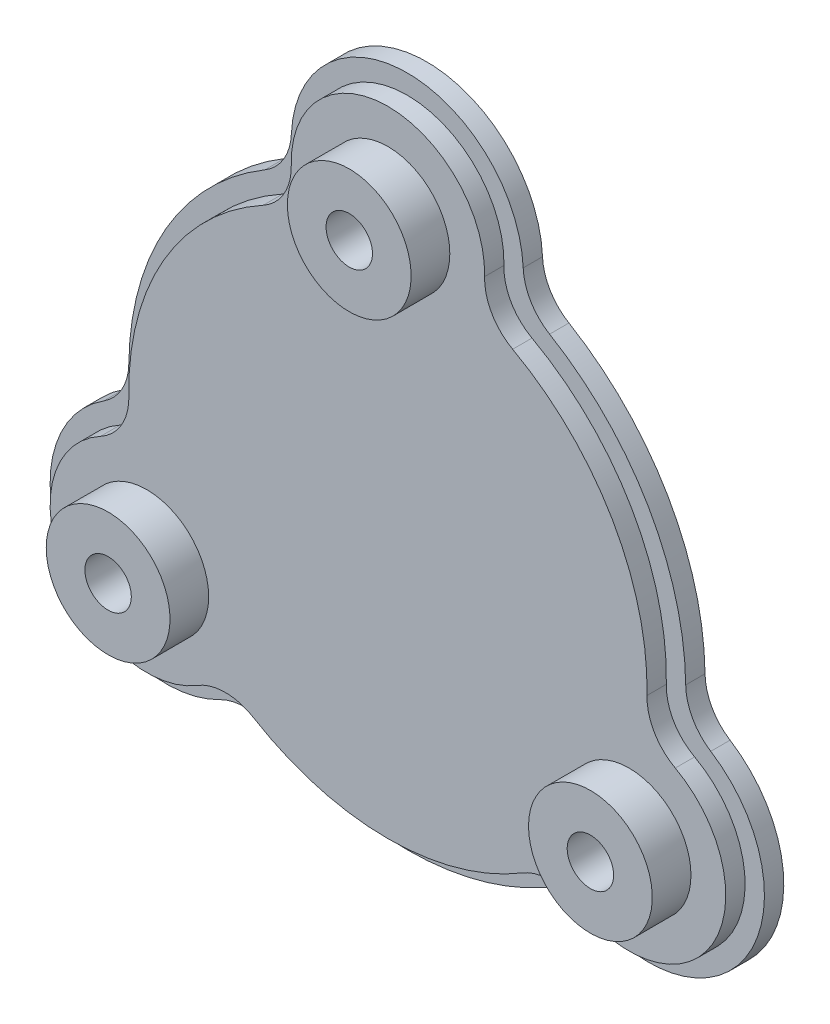
from build123d import *

# Parameters (mm, degrees)
SKETCH1_R           = 5.5
BOSS_EXTRUDE3_DEPTH = 2.5
SKETCH1_7_R         = 5.5
BOSS_EXTRUDE4_DEPTH = 5
SKETCH2_R           = 8
BOSS_EXTRUDE5_DEPTH = 10
SKETCH1_9_R         = 3
CUT_EXTRUDE2_DEPTH  = 70.521992463
SKETCH1_13_R        = 5.5
SKETCH1_13_R_2      = 3
CUT_EXTRUDE3_DEPTH  = 5
FILLET1_R           = 7


with BuildPart() as part:
    # Sketch1 → Boss-Extrude3 (new body)
    with BuildSketch(Plane.XY):
        with BuildLine():
            ThreePointArc((-35.806019271, -3.732155406), (-44.167295593, -25.5), (-21.135151028, -29.142844594))
            ThreePointArc((-21.135151028, -29.142844594), (0, -36), (21.135151028, -29.142844594))
            ThreePointArc((21.135151028, -29.142844594), (44.167295593, -25.5), (35.806019271, -3.732155406))
            ThreePointArc((35.806019271, -3.732155406), (31.176914536, 18), (14.670868243, 32.875))
            ThreePointArc((14.670868243, 32.875), (0, 51), (-14.670868243, 32.875))
            ThreePointArc((-14.670868243, 32.875), (-31.176914536, 18), (-35.806019271, -3.732155406))
        make_face()
        with Locations((-31.176914536, -18)):
            Circle(SKETCH1_R, mode=Mode.SUBTRACT)
        with Locations((31.176914536, -18)):
            Circle(SKETCH1_R, mode=Mode.SUBTRACT)
        with Locations((0, 36)):
            Circle(SKETCH1_R, mode=Mode.SUBTRACT)
    extrude(amount=BOSS_EXTRUDE3_DEPTH)

    # Sketch1<7> → Boss-Extrude4 (add)
    with BuildSketch(Plane.XY):
        with BuildLine():
            ThreePointArc((11.629404781, 31.416666667), (0, 48.5), (-11.629404781, 31.416666667))
            ThreePointArc((-11.629404781, 31.416666667), (-29.011851027, 16.75), (-33.022333826, -5.636973362))
            ThreePointArc((-33.022333826, -5.636973362), (-42.002232084, -24.25), (-21.392929045, -25.779693304))
            ThreePointArc((-21.392929045, -25.779693304), (0, -33.5), (21.392929045, -25.779693304))
            ThreePointArc((21.392929045, -25.779693304), (42.002232084, -24.25), (33.022333826, -5.636973362))
            ThreePointArc((33.022333826, -5.636973362), (29.011851027, 16.75), (11.629404781, 31.416666667))
        make_face()
        with Locations((-31.176914536, -18)):
            Circle(SKETCH1_7_R, mode=Mode.SUBTRACT)
        with Locations((31.176914536, -18)):
            Circle(SKETCH1_7_R, mode=Mode.SUBTRACT)
        with Locations((0, 36)):
            Circle(SKETCH1_7_R, mode=Mode.SUBTRACT)
    extrude(amount=BOSS_EXTRUDE4_DEPTH)

    # Sketch2 → Boss-Extrude5 (add)
    with BuildSketch(Plane(origin=(0, 0, 0), x_dir=(-1, 0, 0), z_dir=(0, 0, -1))):
        with Locations((0, 36)):
            Circle(SKETCH2_R)
        with Locations((-31.176914536, -18)):
            Circle(SKETCH2_R)
        with Locations((31.176914536, -18)):
            Circle(SKETCH2_R)
    extrude(amount=-BOSS_EXTRUDE5_DEPTH)

    # Sketch1<9> → Cut-Extrude2 (cut, through all)
    with BuildSketch(Plane.XY):
        with Locations((-31.176914536, -18)):
            Circle(SKETCH1_9_R)
        with Locations((0, 36)):
            Circle(SKETCH1_9_R)
        with Locations((31.176914536, -18)):
            Circle(SKETCH1_9_R)
    extrude(amount=CUT_EXTRUDE2_DEPTH, mode=Mode.SUBTRACT)

    # Sketch1<13> → Cut-Extrude3 (cut)
    # profile 1 of 3: a face of its own
    with BuildSketch(Plane.XY):
        with Locations((0, 36)):
            Circle(SKETCH1_13_R)
        with Locations((0, 36)):
            Circle(SKETCH1_13_R_2, mode=Mode.SUBTRACT)
    # profile 2 of 3: a face of its own
    with BuildSketch(Plane.XY):
        with Locations((31.176914536, -18)):
            Circle(SKETCH1_13_R)
        with Locations((31.176914536, -18)):
            Circle(SKETCH1_13_R_2, mode=Mode.SUBTRACT)
    # profile 3 of 3: a face of its own
    with BuildSketch(Plane.XY):
        with Locations((-31.176914536, -18)):
            Circle(SKETCH1_13_R)
        with Locations((-31.176914536, -18)):
            Circle(SKETCH1_13_R_2, mode=Mode.SUBTRACT)
    extrude(amount=CUT_EXTRUDE3_DEPTH, mode=Mode.SUBTRACT)

    # Fillet1
    fillet1_edges = [part.edges().sort_by_distance(p)[0] for p in [
        (35.806019271, -3.732155406, 1.25),
        (21.135151028, -29.142844594, 1.25),
        (-21.135151028, -29.142844594, 1.25),
        (-35.806019271, -3.732155406, 1.25),
        (-14.670868243, 32.875, 1.25),
        (14.670868243, 32.875, 1.25),
        (33.022333826, -5.636973362, 3.75),
        (21.392929045, -25.779693304, 3.75),
        (-21.392929045, -25.779693304, 3.75),
        (-33.022333826, -5.636973362, 3.75),
        (-11.629404781, 31.416666667, 3.75),
        (11.629404781, 31.416666667, 3.75),
    ]]
    fillet(fillet1_edges, radius=FILLET1_R)


solid = part.part
